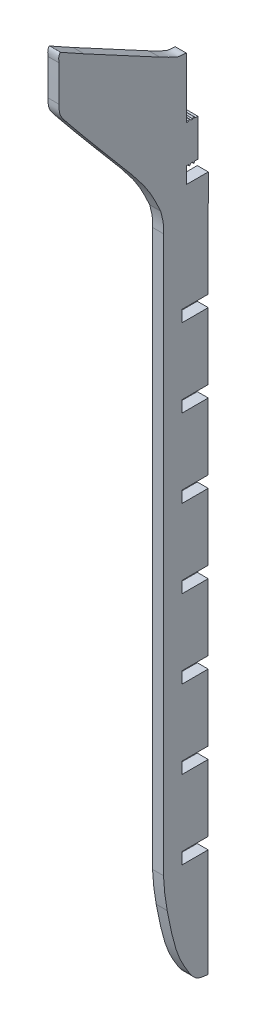
from build123d import *

# Parameters (mm, degrees)
SALIENTE_EXTRUIR1_DEPTH = 2.7


with BuildPart() as part:
    # Croquis1 → Saliente-Extruir1 (new body)
    with BuildSketch(Plane.YZ):
        with BuildLine():
            Line((69.812808286, -8.470319532), (69.813334046, -7.689593095))
            add(Edge.make_bspline(
                [(69.813334046, -7.689593095), (69.718277432, -7.690410058), (69.547216021, -7.691880338), (69.471672568, -7.54230989), (69.43809002, -7.475848405)],
                knots=[0, 0, 0, 0, 0.555650956, 1, 1, 1, 1], degree=3))
            add(Edge.make_bspline(
                [(69.43809002, -7.475848405), (69.485868998, -7.393671243), (69.571854074, -7.245781736), (69.739045293, -7.257082431), (69.813334046, -7.262103715)],
                knots=[0, 0, 0, 0, 0.555665944, 1, 1, 1, 1], degree=3))
            Line((69.813334046, -7.262103715), (69.813334046, -6.619874205))
            add(Edge.make_bspline(
                [(69.813334046, -6.619874205), (69.718281004, -6.62070628), (69.547206259, -6.62220393), (69.471672921, -6.472610717), (69.43809002, -6.406129515)],
                knots=[0, 0, 0, 0, 0.55558677, 1, 1, 1, 1], degree=3))
            add(Edge.make_bspline(
                [(69.43809002, -6.406129515), (69.485868647, -6.323952148), (69.571853089, -6.176062273), (69.739044357, -6.187362253), (69.813333131, -6.192383218)],
                knots=[0, 0, 0, 0, 0.555665944, 1, 1, 1, 1], degree=3))
            Line((69.813333131, -6.192383218), (69.812808286, -5.620390327))
            Line((69.812808286, -5.620390327), (65.824387706, -5.620390327))
            Line((65.824387706, -5.620390327), (65.823902281, -11.032305972))
            Line((65.823902281, -11.032305972), (39.747713095, -11.02806406))
            Line((39.747713095, -11.02806406), (39.748770289, -4.529207726))
            Line((39.748770289, -4.529207726), (36.898770326, -4.528744106))
            Line((36.898770326, -4.528744106), (36.897713133, -11.02760044))
            Line((36.897713133, -11.02760044), (20.486813862, -11.024930817))
            Line((20.486813862, -11.024930817), (20.487871055, -4.526074483))
            Line((20.487871055, -4.526074483), (17.637871093, -4.525610863))
            Line((17.637871093, -4.525610863), (17.636813899, -11.024467197))
            Line((17.636813899, -11.024467197), (1.226003887, -11.021797589))
            Line((1.226003887, -11.021797589), (1.22706108, -4.522941255))
            Line((1.22706108, -4.522941255), (-1.622938882, -4.522477635))
            Line((-1.622938882, -4.522477635), (-1.623996075, -11.021333969))
            Line((-1.623996075, -11.021333969), (-18.034716829, -11.018664376))
            Line((-18.034716829, -11.018664376), (-18.033659636, -4.519808041))
            Line((-18.033659636, -4.519808041), (-20.883659598, -4.519344421))
            Line((-20.883659598, -4.519344421), (-20.884716791, -11.018200756))
            Line((-20.884716791, -11.018200756), (-37.295526804, -11.015531148))
            Line((-37.295526804, -11.015531148), (-37.29446961, -4.516674813))
            Line((-37.29446961, -4.516674813), (-40.144469572, -4.516211193))
            Line((-40.144469572, -4.516211193), (-40.145526766, -11.015067527))
            Line((-40.145526766, -11.015067527), (-56.556426037, -11.012397905))
            Line((-56.556426037, -11.012397905), (-56.555368844, -4.51354157))
            Line((-56.555368844, -4.51354157), (-59.405368806, -4.51307795))
            Line((-59.405368806, -4.51307795), (-59.406426, -11.011934285))
            Line((-59.406426, -11.011934285), (-75.831996924, -11.009262276))
            Line((-75.831996924, -11.009262276), (-75.83152263, -4.510149615))
            Line((-75.83152263, -4.510149615), (-78.681522622, -4.509941627))
            Line((-78.681522622, -4.509941627), (-78.681996897, -11.008797361))
            Line((-78.681996897, -11.008797361), (-105.238788458, -11.008784177))
            add(Edge.make_bspline(
                [(-105.238788458, -11.008784177), (-105.14858271, -9.983450496), (-104.978798579, -8.052437708), (-103.415932971, -6.929206638), (-102.682870886, -6.402391424)],
                knots=[0, 0, 0, 0, 0.530982335, 1, 1, 1, 1], degree=3))
            add(Edge.make_bspline(
                [(-102.682870886, -6.402391424), (-101.394696585, -5.608529448), (-98.694632001, -3.944563162), (-93.215658737, -2.20965482), (-89.098251838, -1.412949472), (-86.602670214, -0.930072072)],
                knots=[0, 0, 0, 0, 0.264376639, 0.554143954, 1, 1, 1, 1], degree=3))
            add(Edge.make_bspline(
                [(-86.602670214, -0.930072072), (-84.973156703, -0.655698226), (-82.349752651, -0.213975311), (-79.694903541, -0.065172296), (-78.68908292, -0.008797357)],
                knots=[0, 0, 0, 0, 0.621144695, 1, 1, 1, 1], degree=3))
            Line((-78.68908292, -0.008797357), (58.126350502, -0.031053636))
            add(Edge.make_bspline(
                [(58.126350502, -0.031053636), (59.046945941, -0.03224198), (60.812517807, -0.034520976), (62.507529104, 0.456023838), (63.318712092, 0.690787646)],
                knots=[0, 0, 0, 0, 0.521422257, 1, 1, 1, 1], degree=3))
            add(Edge.make_bspline(
                [(63.318712092, 0.690787646), (65.143843319, 1.534523648), (69.06884794, 3.349005621), (75.404798534, 8.3094659), (79.947417099, 12.214266662), (82.743307297, 14.617606967)],
                knots=[0, 0, 0, 0, 0.250491315, 0.538689797, 1, 1, 1, 1], degree=3))
            add(Edge.make_bspline(
                [(82.743307297, 14.617606967), (85.047253105, 16.558828686), (88.71509394, 19.64921921), (92.441979531, 22.668023582), (93.827809061, 23.790572912)],
                knots=[0, 0, 0, 0, 0.628147706, 1, 1, 1, 1], degree=3))
            add(Edge.make_bspline(
                [(93.827809061, 23.790572912), (94.326453815, 24.199541627), (95.135569145, 24.863146035), (96.707492067, 25.728920147), (97.846009019, 25.692304846), (98.572307919, 25.668946364)],
                knots=[0, 0, 0, 0, 0.367687723, 0.596620683, 1, 1, 1, 1], degree=3))
            add(Edge.make_bspline(
                [(98.572307919, 25.668946364), (100.246973397, 25.678065075), (103.185898824, 25.694067802), (106.124806248, 25.676478931), (107.389032296, 25.668912593)],
                knots=[0, 0, 0, 0, 0.569822379, 1, 1, 1, 1], degree=3))
            add(Edge.make_bspline(
                [(107.389032296, 25.668912593), (108.060345413, 25.782878894), (108.783157194, 25.905587929), (109.548911413, 25.42625634), (109.482646974, 25.30201883), (109.444862485, 25.231273086)],
                knots=[0, 0, 0, 0, 0.848773339, 0.913885568, 1, 1, 1, 1], degree=3))
            add(Edge.make_bspline(
                [(109.444862485, 25.231273086), (109.370914057, 25.095380771), (109.105061218, 24.606832759), (108.522748832, 23.585003774), (107.54556697, 21.821989367), (106.764907477, 20.409086507), (106.284004774, 19.538728729)],
                knots=[0, 0, 0, 0, 0.071280186, 0.25626021, 0.541851204, 1, 1, 1, 1], degree=3))
            add(Edge.make_bspline(
                [(106.284004774, 19.538728729), (105.396909739, 17.909312095), (103.467658207, 14.365661847), (100.765990032, 9.360901344), (98.30554125, 4.781237125), (96.897745784, 2.110339814), (96.260543385, 0.901427017)],
                knots=[0, 0, 0, 0, 0.263007015, 0.571986842, 0.806270881, 1, 1, 1, 1], degree=3))
            add(Edge.make_bspline(
                [(96.260543385, 0.901427017), (95.874219388, 0.16818648), (95.240639904, -1.034343432), (94.500820955, -2.629812191), (93.945424943, -3.699029848), (93.988367719, -4.702342381), (93.914153339, -5.268329777), (93.868207957, -5.618726914)],
                knots=[0, 0, 0, 0, 0.352336975, 0.577840053, 0.756569684, 0.849294726, 1, 1, 1, 1], degree=3))
            Line((93.868207957, -5.618726914), (80.21346475, -5.623578454))
            Line((80.21346475, -5.623578454), (78.979630239, -5.623578454))
            Line((78.979630239, -5.623578454), (78.979601353, -6.200689117))
            add(Edge.make_bspline(
                [(78.979601353, -6.200689117), (79.074601125, -6.197779206), (79.245599405, -6.192542495), (79.324419315, -6.340422695), (79.359440945, -6.406129515)],
                knots=[0, 0, 0, 0, 0.555675338, 1, 1, 1, 1], degree=3))
            add(Edge.make_bspline(
                [(79.359440945, -6.406129515), (79.313479796, -6.48935539), (79.230789249, -6.639125118), (79.063383476, -6.631474374), (78.989003792, -6.628075089)],
                knots=[0, 0, 0, 0, 0.55569224, 1, 1, 1, 1], degree=3))
            Line((78.989003792, -6.628075089), (78.98995964, -7.269308448))
            add(Edge.make_bspline(
                [(78.98995964, -7.269308448), (79.085013314, -7.269607654), (79.256084268, -7.270146125), (79.329866383, -7.420596942), (79.36264575, -7.487448234)],
                knots=[0, 0, 0, 0, 0.555660155, 1, 1, 1, 1], degree=3))
            add(Edge.make_bspline(
                [(79.36264575, -7.487448234), (79.313911322, -7.569057991), (79.226204836, -7.715929624), (79.05916077, -7.702663194), (78.984935347, -7.696768304)],
                knots=[0, 0, 0, 0, 0.555653639, 1, 1, 1, 1], degree=3))
            Line((78.984935347, -7.696768304), (78.983701144, -8.470319532))
            Line((78.983701144, -8.470319532), (69.812808286, -8.470319532))
        make_face()
    extrude(amount=SALIENTE_EXTRUIR1_DEPTH)


solid = part.part
